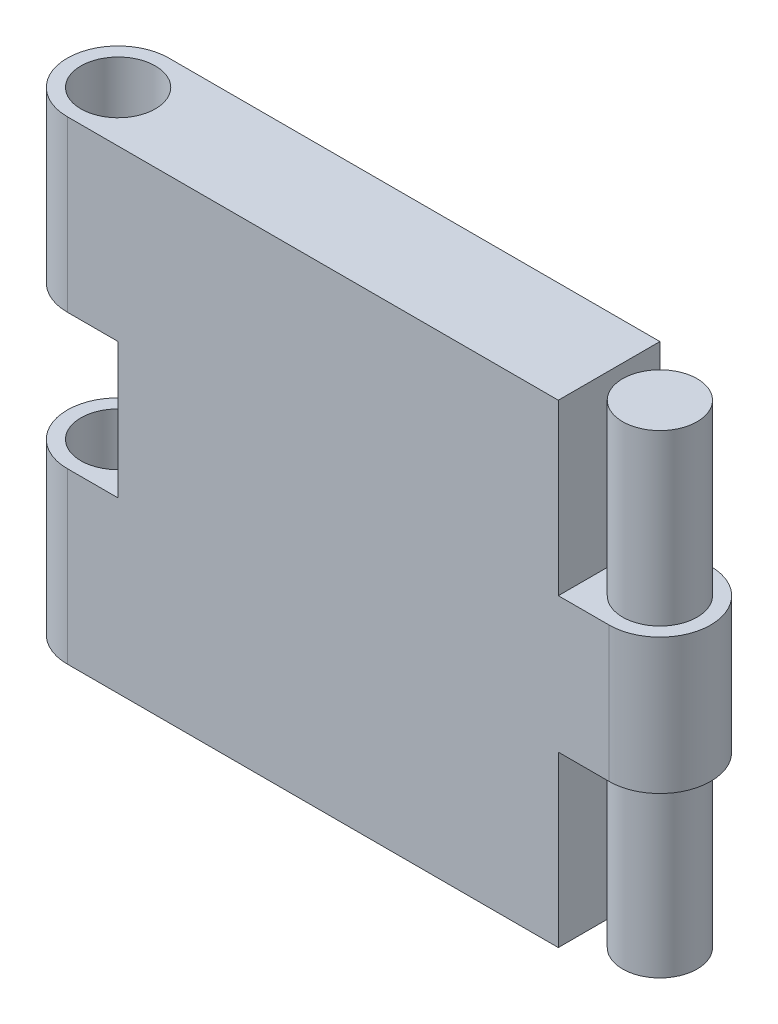
from build123d import *

# Parameters (mm, degrees)
PLATE_SKETCH_W                 = 80
PLATE_SKETCH_H                 = 70
PLATE_EXTRUDE_DEPTH            = 15
HOLE_CUT_REACH                 = 57.227
HOLE_SKETCH_R                  = 5.5
HOLE_CUT_DIRECTION_2_REACH     = 57.227
FEMALE_FILLET_RADIUS           = 7.5
FEMALE_FILLET_LENGTH           = 70
GAP_CUT_DEPTH                  = 10
GAP_CUT_DEPTH_BACK             = 10
GAP_SKETCH_W                   = 15
GAP_SKETCH_H                   = 15
PIN_SUPPORT_EXTRUDE_DEPTH      = 10
PIN_SUPPORT_EXTRUDE_DEPTH_BACK = 10
PIN_SUPPORT_SKETCH_W           = 15
PIN_SUPPORT_SKETCH_H           = 15
PIN_EXTRUDE_REACH              = 74.629
PIN_SKETCH_R                   = 5.5
PIN_EXTRUDE_DIRECTION_2_REACH  = 74.629
MALE_FILLET_RADIUS             = 7.5
MALE_FILLET_LENGTH             = 20


with BuildPart() as part:
    # Plate Sketch → Plate Extrude (new body)
    with BuildSketch(Plane.XY):
        Rectangle(PLATE_SKETCH_W, PLATE_SKETCH_H)
    extrude(amount=-PLATE_EXTRUDE_DEPTH)

    # Hole Cut: up to this face of the body (flat: up to its plane)
    hole_cut_end = Plane(part.part.faces().sort_by_distance((0, 35, -7.5))[0])
    # Hole Sketch → Hole Cut (cut, up to the picked face)
    with BuildSketch(Plane(origin=(0, 0, 0), x_dir=(1, 0, 0), z_dir=(0, 1, 0)), mode=Mode.PRIVATE) as hole_cut_sk1:
        with Locations(Location((-32.5, 7.5, 0), (0, 0, 90))):
            Circle(HOLE_SKETCH_R)
    hole_cut_tool1 = split(extrude(hole_cut_sk1.sketch, amount=HOLE_CUT_REACH, mode=Mode.PRIVATE), bisect_by=hole_cut_end, keep=Keep.BOTH, mode=Mode.PRIVATE)
    add(hole_cut_tool1.solids().sort_by(Axis((-32.5, 0, -7.5), (0, 1, 0)))[0], mode=Mode.SUBTRACT)

    # Hole Cut direction 2: up to this face of the body (flat: up to its plane)
    hole_cut_direction_2_end = Plane(part.part.faces().sort_by_distance((0, -35, -7.5))[0])
    # Hole Sketch → Hole Cut direction 2 (cut, up to the picked face)
    with BuildSketch(Plane(origin=(0, 0, 0), x_dir=(1, 0, 0), z_dir=(0, 1, 0)), mode=Mode.PRIVATE) as hole_cut_direction_2_sk1:
        with Locations(Location((-32.5, 7.5, 0), (0, 0, 90))):
            Circle(HOLE_SKETCH_R)
    hole_cut_direction_2_tool1 = split(extrude(hole_cut_direction_2_sk1.sketch, amount=-HOLE_CUT_DIRECTION_2_REACH, mode=Mode.PRIVATE), bisect_by=hole_cut_direction_2_end, keep=Keep.BOTH, mode=Mode.PRIVATE)
    add(hole_cut_direction_2_tool1.solids().sort_by(Axis((-32.5, 0, -7.5), (0, -1, 0)))[0], mode=Mode.SUBTRACT)

    # Female Fillet: full round fillet: the end face becomes a half cylinder, R = half its width
    female_fillet_face = Plane((-40, 0, -7.5), x_dir=(0, -1, 0), z_dir=(-1, 0, 0))  # on the end face: x along it, z out of the body
    female_fillet_slab = female_fillet_face.offset(-FEMALE_FILLET_RADIUS / 2) * Box(FEMALE_FILLET_LENGTH, 2 * FEMALE_FILLET_RADIUS, FEMALE_FILLET_RADIUS, mode=Mode.PRIVATE)  # the body's end, R deep
    female_fillet_round = Plane((-32.5, 0, -7.5), x_dir=(-1, 0, 0), z_dir=(0, -1, 0)) * Cylinder(FEMALE_FILLET_RADIUS, FEMALE_FILLET_LENGTH, mode=Mode.PRIVATE)  # its axis R under the face
    add(female_fillet_slab - female_fillet_round, mode=Mode.SUBTRACT)

    # Gap Sketch → Gap Cut (cut, two sides: drawn at the far end of the back side and taken through both)
    with BuildSketch(Plane(origin=(0, 0, 0), x_dir=(1, 0, 0), z_dir=(0, 1, 0)).offset(-GAP_CUT_DEPTH_BACK)):
        with Locations((-32.5, 7.5)):
            Rectangle(GAP_SKETCH_W, GAP_SKETCH_H)
    extrude(amount=GAP_CUT_DEPTH + GAP_CUT_DEPTH_BACK, mode=Mode.SUBTRACT)

    # Pin Support Sketch → Pin Support Extrude (add, two sides: drawn at the far end of the back side and taken through both)
    with BuildSketch(Plane(origin=(0, 0, 0), x_dir=(1, 0, 0), z_dir=(0, 1, 0)).offset(-PIN_SUPPORT_EXTRUDE_DEPTH_BACK)):
        with Locations((47.5, 7.5)):
            Rectangle(PIN_SUPPORT_SKETCH_W, PIN_SUPPORT_SKETCH_H)
    extrude(amount=PIN_SUPPORT_EXTRUDE_DEPTH + PIN_SUPPORT_EXTRUDE_DEPTH_BACK)

    # Pin Extrude: up to this face of the body (flat: up to its plane)
    pin_extrude_end = Plane(part.part.faces().sort_by_distance((3.713685867, 35, -7.5))[0])
    # Pin Sketch → Pin Extrude (add, up to the picked face)
    with BuildSketch(Plane(origin=(0, 10, 0), x_dir=(1, 0, 0), z_dir=(0, 1, 0)), mode=Mode.PRIVATE) as pin_extrude_sk1:
        with Locations(Location((47.5, 7.5, 0), (0, 0, 90))):
            Circle(PIN_SKETCH_R)
    pin_extrude_tool1 = split(extrude(pin_extrude_sk1.sketch, amount=PIN_EXTRUDE_REACH, mode=Mode.PRIVATE), bisect_by=pin_extrude_end, keep=Keep.BOTH, mode=Mode.PRIVATE)
    add(pin_extrude_tool1.solids().sort_by(Axis((47.5, 10, -7.5), (0, 1, 0)))[0])

    # Pin Extrude direction 2: up to this face of the body (flat: up to its plane)
    pin_extrude_direction_2_end = Plane(part.part.faces().sort_by_distance((3.713685867, -35, -7.5))[0])
    # Pin Sketch → Pin Extrude direction 2 (add, up to the picked face)
    with BuildSketch(Plane(origin=(0, 10, 0), x_dir=(1, 0, 0), z_dir=(0, 1, 0)), mode=Mode.PRIVATE) as pin_extrude_direction_2_sk1:
        with Locations(Location((47.5, 7.5, 0), (0, 0, 90))):
            Circle(PIN_SKETCH_R)
    pin_extrude_direction_2_tool1 = split(extrude(pin_extrude_direction_2_sk1.sketch, amount=-PIN_EXTRUDE_DIRECTION_2_REACH, mode=Mode.PRIVATE), bisect_by=pin_extrude_direction_2_end, keep=Keep.BOTH, mode=Mode.PRIVATE)
    add(pin_extrude_direction_2_tool1.solids().sort_by(Axis((47.5, 10, -7.5), (0, -1, 0)))[0])

    # Male Fillet: full round fillet: the end face becomes a half cylinder, R = half its width
    male_fillet_face = Plane((55, 0, -7.5), x_dir=(0, 1, 0), z_dir=(1, 0, 0))  # on the end face: x along it, z out of the body
    male_fillet_slab = male_fillet_face.offset(-MALE_FILLET_RADIUS / 2) * Box(MALE_FILLET_LENGTH, 2 * MALE_FILLET_RADIUS, MALE_FILLET_RADIUS, mode=Mode.PRIVATE)  # the body's end, R deep
    male_fillet_round = Plane((47.5, 0, -7.5), x_dir=(1, 0, 0), z_dir=(0, 1, 0)) * Cylinder(MALE_FILLET_RADIUS, MALE_FILLET_LENGTH, mode=Mode.PRIVATE)  # its axis R under the face
    add(male_fillet_slab - male_fillet_round, mode=Mode.SUBTRACT)


solid = part.part
